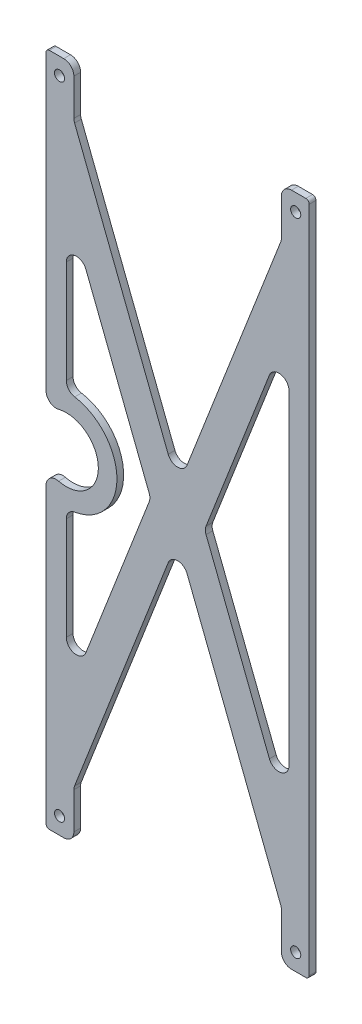
from build123d import *
from build123d.topology import SkipClean

# Parameters (mm, degrees)
EXTRUDE_1_DEPTH     = 2
SKETCH_4_R          = 1.5
CUT_EXTRUDE_3_DEPTH = 108.354552768
FILLET_4_R          = 1
CUT_EXTRUDE_5_DEPTH = 108.354552768
FILLET_7_R          = 3
EXTRUDE_2_DEPTH     = 2
CUT_EXTRUDE_6_DEPTH = 108.354552899
FILLET_8_R          = 3


with BuildPart() as part:
    # 草图1 → 凸台-拉伸1 (new body)
    with BuildSketch(Plane.XY):
        Polygon((39, 79.487179487), (33, 64.102564103), (33, -64.102564103), (39, -79.487179487), align=None)
        Polygon((33, -64.102564103), (8, 0), (0, -20.512820513), (31, -100), (39, -100), (39, -79.487179487), align=None)
        Polygon((-31, -100), (0, -20.512820513), (-8, 0), (-33, -64.102564103), (-39, -79.487179487), (-39, -100), align=None)
        Polygon((-33, -64.102564103), (-33, 64.102564103), (-39, 79.487179487), (-39, -79.487179487), align=None)
        Polygon((0, -20.512820513), (8, 0), (0, 20.512820513), (-8, 0), align=None)
        Polygon((8, 0), (33, 64.102564103), (39, 79.487179487), (39, 100), (31, 100), (0, 20.512820513), align=None)
        Polygon((-8, 0), (0, 20.512820513), (-31, 100), (-39, 100), (-39, 79.487179487), (-33, 64.102564103), align=None)
    extrude(amount=EXTRUDE_1_DEPTH)

    # 草图4 → 切除-拉伸3 (cut, through all)
    with BuildSketch(Plane.XY.offset(2)):
        with Locations((-35, 95)):
            Circle(SKETCH_4_R)
        with Locations(Location((-35, -95, 0), (0, 0, 180))):
            Circle(SKETCH_4_R)
        with Locations((35, -95)):
            Circle(SKETCH_4_R)
        with Locations(Location((35, 95, 0), (0, 0, 180))):
            Circle(SKETCH_4_R)
    extrude(amount=-CUT_EXTRUDE_3_DEPTH, mode=Mode.SUBTRACT)

    # 圆角4
    fillet_4_edges = [part.edges().sort_by_distance(p)[0] for p in [
        (39, -100, 1),
        (31, -100, 1),
        (-31, -100, 1),
        (-39, -100, 1),
        (-39, 100, 1),
        (-31, 100, 1),
        (31, 100, 1),
        (39, 100, 1),
    ]]
    fillet(fillet_4_edges, radius=FILLET_4_R)

    # 草图6 → 切除-拉伸5 (cut, through all)
    with BuildSketch(Plane.XY.offset(2)):
        Polygon((-30.751704658, -85.602329726), (-30.751704658, -99.363345276), (0, -20.512820513), (30.751704658, -99.363345276), (30.751704658, -85.602329726), (0, -6.751804962), align=None)
        Polygon((30.751704658, 85.602329726), (30.751704658, 99.363345276), (0, 20.512820513), (-30.751704658, 99.363345276), (-30.751704658, 85.602329726), (0, 6.751804962), align=None)
    extrude(amount=-CUT_EXTRUDE_5_DEPTH, mode=Mode.SUBTRACT)

    # 圆角7
    fillet_7_edges = [part.edges().sort_by_distance(p)[0] for p in [
        (30.751704658, 85.602329726, 1),
        (0, 6.751804962, 1),
        (-30.751704658, 85.602329726, 1),
        (-30.751704658, 99.363345276, 1),
        (-30.751704658, -99.363345276, 1),
        (0, -6.751804962, 1),
        (30.751704658, -85.602329726, 1),
        (30.751704658, -99.363345276, 1),
        (30.751704658, 99.363345276, 1),
        (33, 64.102564103, 1),
        (33, -64.102564103, 1),
        (8, 0, 1),
        (-8, 0, 1),
        (-33, -64.102564103, 1),
        (-33, 64.102564103, 1),
        (-30.751704658, -85.602329726, 1),
    ]]
    fillet(fillet_7_edges, radius=FILLET_7_R)

    # 草图7 → 凸台-拉伸2 (add, through all)
    with BuildSketch(Plane.XY.offset(2)):
        with BuildLine():
            ThreePointArc((-33, 9.5), (-26.282485579, 6.717514421), (-23.5, 0))
            ThreePointArc((-23.5, 0), (-26.282485579, -6.717514421), (-33, -9.5))
            Line((-33, -9.5), (-33, -15))
            ThreePointArc((-33, -15), (-22.393398282, -10.606601718), (-18, 0))
            ThreePointArc((-18, 0), (-22.393398282, 10.606601718), (-33, 15))
            Line((-33, 15), (-33, 9.5))
        make_face()
    extrude(amount=-EXTRUDE_2_DEPTH)

    # 草图7<4> → 切除-拉伸6 (cut, through all)
    with SkipClean():  # the faces are left unmerged after this step: merging them gives an invalid solid
        with BuildSketch(Plane.XY.offset(2)):
            with BuildLine():
                Line((-33, -9.5), (-33, 9.5))
                ThreePointArc((-33, 9.5), (-36.184189901, 8.950471198), (-39, 7.365459931))
                Line((-39, 7.365459931), (-39, -7.365459931))
                ThreePointArc((-39, -7.365459931), (-36.184189901, -8.950471198), (-33, -9.5))
            make_face()
        extrude(amount=-CUT_EXTRUDE_6_DEPTH, mode=Mode.SUBTRACT)

    # 圆角8
    fillet_8_edges = [part.edges().sort_by_distance(p)[0] for p in [
        (-33, -15, 1),
        (-33, 15, 1),
        (-39, -7.365459931, 1),
        (-39, 7.365459931, 1),
    ]]
    fillet(fillet_8_edges, radius=FILLET_8_R)


solid = part.part
